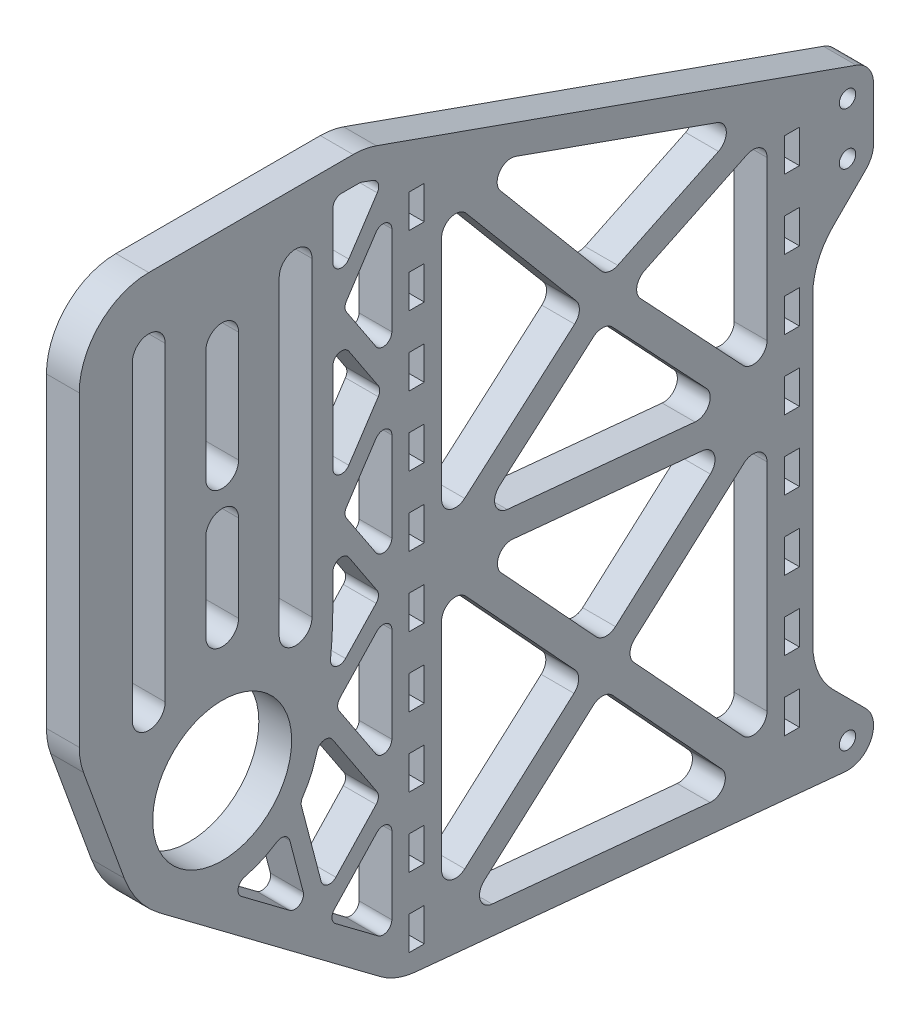
from build123d import *

# Parameters (mm, degrees)
SKETCH4_R               = 1.5
SKETCH4_R_2             = 19.05
SKETCH4_R_3             = 12.7
BOSS_EXTRUDE1_DEPTH     = 3
SKETCH5_W               = 2.75
SKETCH5_H               = 6.096
LOWERSLOT_DEPTH         = 120.792356667
SKETCH5_3_W             = 2.75
SKETCH5_3_H             = 6.096
UPPERSLOT_DEPTH         = 120.792356667
LOWERSLOTS_COUNT        = 8
LOWERSLOTS_PITCH        = 12.7
LPATTERN2_COUNT         = 10
LPATTERN2_PITCH         = 12.7
CUT_EXTRUDE1_DEPTH      = 120.792356667
CUT_EXTRUDE1_DEPTH_BACK = 120.792356667
CUT_EXTRUDE2_DEPTH      = 120.792356667
CUT_EXTRUDE2_DEPTH_BACK = 120.792356667
FILLET1_R               = 2.54
FILLET2_R               = 1.5875
FILLET3_R               = 12.7


with BuildPart() as part:
    # Sketch4 → Boss-Extrude1 (new, symmetric)
    # profile 1 of 3: a face of its own
    with BuildSketch(Plane(origin=(0, 0, 0), x_dir=(0, 0, -1), z_dir=(1, 0, 0))):
        with BuildLine():
            ThreePointArc((47.817596045, 22.032403955), (48.849976274, 23.577470153), (49.2125, 25.4))
            Line((49.2125, 25.4), (49.2125, 34.925))
            ThreePointArc((49.2125, 34.925), (48.339904561, 37.672735205), (46.041875851, 39.413578564))
            Line((46.041875851, 39.413578564), (-43.726606241, 71.25))
            Line((-43.726606241, 71.25), (-95.973393759, 71.25))
            Line((-95.973393759, 71.25), (-95.973393759, 0.199960648))
            Line((-95.973393759, 0.199960648), (-87.751144426, -22.39048373))
            ThreePointArc((-87.751144426, -22.39048373), (-73.157997785, 2.885587695), (-50.8, -15.875))
            ThreePointArc((-50.8, -15.875), (-61.330581006, -32.913837989), (-81.28, -31.115))
            Line((-81.28, -31.115), (-38.1, -63.5))
            Line((-38.1, -63.5), (43.992912904, -71.415514491))
            ThreePointArc((43.992912904, -71.415514491), (48.757334408, -68.706816071), (47.817596045, -63.307403955))
            Line((47.817596045, -63.307403955), (38.1, -53.589807909))
            Line((38.1, -53.589807909), (38.1, 12.314807909))
            Line((38.1, 12.314807909), (47.817596045, 22.032403955))
        make_face()
        with Locations((44.45, -66.675)):
            Circle(SKETCH4_R, mode=Mode.SUBTRACT)
        with BuildLine():
            ThreePointArc((-80.273393759, 1.775), (-83.273393759, -1.225), (-86.273393759, 1.775))
            Line((-86.273393759, 1.775), (-86.273393759, 58.55))
            ThreePointArc((-86.273393759, 58.55), (-83.273393759, 61.55), (-80.273393759, 58.55))
            Line((-80.273393759, 58.55), (-80.273393759, 1.775))
        make_face(mode=Mode.SUBTRACT)
        with BuildLine():
            ThreePointArc((-66.85, 8.3125), (-69.85, 5.3125), (-72.85, 8.3125))
            Line((-72.85, 8.3125), (-72.85, 24.1875))
            Line((-72.85, 24.1875), (-72.85, 33.3625))
            Line((-72.85, 33.3625), (-72.85, 53.6))
            ThreePointArc((-72.85, 53.6), (-69.85, 56.6), (-66.85, 53.6))
            Line((-66.85, 53.6), (-66.85, 33.3625))
            Line((-66.85, 33.3625), (-66.85, 24.1875))
            Line((-66.85, 24.1875), (-66.85, 8.3125))
        make_face(mode=Mode.SUBTRACT)
        with BuildLine():
            ThreePointArc((-53.426606241, 1.775), (-56.426606241, -1.225), (-59.426606241, 1.775))
            Line((-59.426606241, 1.775), (-59.426606241, 58.55))
            ThreePointArc((-59.426606241, 58.55), (-56.426606241, 61.55), (-53.426606241, 58.55))
            Line((-53.426606241, 58.55), (-53.426606241, 1.775))
        make_face(mode=Mode.SUBTRACT)
        with Locations((44.45, 25.4)):
            Circle(SKETCH4_R, mode=Mode.SUBTRACT)
        with Locations((44.45, 34.925)):
            Circle(SKETCH4_R, mode=Mode.SUBTRACT)
    # profile 2 of 3: a face of its own
    with BuildSketch(Plane(origin=(0, 0, 0), x_dir=(0, 0, -1), z_dir=(1, 0, 0))):
        with Locations((-69.85, -15.875)):
            Circle(SKETCH4_R_2)
        with Locations((-69.85, -15.875)):
            Circle(SKETCH4_R_3, mode=Mode.SUBTRACT)
    # profile 3 of 3: a face of its own
    with BuildSketch(Plane(origin=(0, 0, 0), x_dir=(0, 0, -1), z_dir=(1, 0, 0))):
        with BuildLine():
            Line((-72.85, 33.3625), (-72.85, 24.1875))
            ThreePointArc((-72.85, 24.1875), (-69.85, 27.1875), (-66.85, 24.1875))
            Line((-66.85, 24.1875), (-66.85, 33.3625))
            ThreePointArc((-66.85, 33.3625), (-69.85, 30.3625), (-72.85, 33.3625))
        make_face()
    extrude(amount=BOSS_EXTRUDE1_DEPTH, both=True)

    # Sketch5 → LowerSlot (cut, symmetric)
    with BuildSketch(Plane(origin=(3, 0, 0), x_dir=(0, 0, -1), z_dir=(1, 0, 0))):
        with Locations((34.29, -57.15)):
            Rectangle(SKETCH5_W, SKETCH5_H)
    lowerslot = extrude(amount=LOWERSLOT_DEPTH, both=True, mode=Mode.SUBTRACT)

    # Sketch5<3> → UpperSlot (cut, symmetric)
    with BuildSketch(Plane(origin=(3, 0, 0), x_dir=(0, 0, -1), z_dir=(1, 0, 0))):
        with Locations((-34.29, -57.15)):
            Rectangle(SKETCH5_3_W, SKETCH5_3_H)
    upperslot = extrude(amount=UPPERSLOT_DEPTH, both=True, mode=Mode.SUBTRACT)

    # LowerSlots: LowerSlot ×8
    with Locations(*[(0, i * LOWERSLOTS_PITCH, 0) for i in range(1, LOWERSLOTS_COUNT)]):
        add(lowerslot, mode=Mode.SUBTRACT)

    # LPattern2: UpperSlot ×10
    with Locations(*[(0, i * LPATTERN2_PITCH, 0) for i in range(1, LPATTERN2_COUNT)]):
        add(upperslot, mode=Mode.SUBTRACT)

    # Sketch6 → Cut-Extrude1 (cut, two sides: drawn at the far end of the back side and taken through both)
    with BuildSketch(Plane(origin=(3, 0, 0), x_dir=(0, 0, -1), z_dir=(1, 0, 0)).offset(-CUT_EXTRUDE1_DEPTH_BACK)):
        Polygon((-29.74, -4.159515549), (-29.74, -55.798883328), (-3.617530932, -32.497964764), align=None)
        Polygon((-0.173977051, -36.233636783), (-26.296446119, -59.534555348), (25.948492017, -64.572085997), align=None)
        Polygon((29.74, -9.550740101), (3.617530932, -32.851658666), (29.74, -61.190107881), align=None)
        Polygon((-23.36678753, -3.578249007), (0.173977051, -29.115986647), (23.714741632, -8.117916479), align=None)
        Polygon((-0.175685561, 22.007624532), (-23.626632395, 1.550365573), (23.275261273, -2.971981191), align=None)
        Polygon((4.225161053, 24.741958988), (29.74, -2.436074441), (29.74, 36.987638329), align=None)
        Polygon((26.36423534, 41.002246475), (-25.011163091, 59.222548276), (0.676536125, 28.673603984), align=None)
        Polygon((-29.74, 56.952974066), (-29.74, 2.958675399), (-3.549347816, 25.805895933), align=None)
    extrude(amount=CUT_EXTRUDE1_DEPTH + CUT_EXTRUDE1_DEPTH_BACK, mode=Mode.SUBTRACT)

    # Sketch6<3> → Cut-Extrude2 (cut, two sides: drawn at the far end of the back side and taken through both)
    with BuildSketch(Plane(origin=(3, 0, 0), x_dir=(0, 0, -1), z_dir=(1, 0, 0)).offset(-CUT_EXTRUDE2_DEPTH_BACK)):
        with BuildLine():
            Line((-69.433181898, -33.650113577), (-53.885950089, -45.310537433))
            Line((-53.885950089, -45.310537433), (-58.099239453, -29.218463815))
            ThreePointArc((-58.099239453, -29.218463815), (-63.375251167, -32.434167478), (-69.433181898, -33.650113577))
        make_face()
        Polygon((-50.566109593, -47.800417805), (-38.84, -56.595), (-38.84, -35.323421976), align=None)
        with BuildLine():
            ThreePointArc((-52.744055381, -20.724232793), (-53.887483076, -23.70612083), (-55.545901002, -26.435357563))
            Line((-55.545901002, -26.435357563), (-51.035185303, -43.663409762))
            Line((-51.035185303, -43.663409762), (-40.856390127, -32.832811265))
            Line((-40.856390127, -32.832811265), (-51.660229876, -16.473291387))
            ThreePointArc((-51.660229876, -16.473291387), (-52.173880395, -18.605967866), (-52.744055381, -20.724232793))
        make_face()
        Polygon((-49.180428609, -14.466821123), (-38.84, -30.124629024), (-38.84, -3.464238929), align=None)
        with BuildLine():
            ThreePointArc((-49.616606241, 1.775), (-49.882802907, -4.846843128), (-50.679674961, -11.425951122))
            Line((-50.679674961, -11.425951122), (-40.856390127, -0.973628217))
            Line((-40.856390127, -0.973628217), (-49.616606241, 12.291371355))
            Line((-49.616606241, 12.291371355), (-49.616606241, 1.775))
        make_face()
        Polygon((-47.71416834, 15.172103704), (-38.84, 1.734554024), (-38.84, 28.609653385), align=None)
        Polygon((-49.616606241, 44.927935415), (-49.616606241, 18.052836053), (-40.742437901, 31.490385734), align=None)
        Polygon((-47.71416834, 47.808667764), (-38.84, 34.371118083), (-38.84, 61.246217444), align=None)
        Polygon((-44.600745323, 66.17), (-49.616606241, 66.17), (-49.616606241, 58.55), (-49.616606241, 50.689400113), (-40.381419868, 64.673614852), align=None)
    extrude(amount=CUT_EXTRUDE2_DEPTH + CUT_EXTRUDE2_DEPTH_BACK, mode=Mode.SUBTRACT)

    # Fillet1
    fillet1_edges = [part.edges().sort_by_distance(p)[0] for p in [
        (0, -2.971981191, -23.275261273),
        (0, 1.550365573, 23.626632395),
        (0, 22.007624532, 0.175685561),
        (0, -3.578249007, 23.36678753),
        (0, -8.117916479, -23.714741632),
        (0, -29.115986647, -0.173977051),
        (0, -36.233636783, 0.173977051),
        (0, -64.572085997, -25.948492017),
        (0, -59.534555348, 26.296446119),
        (0, -32.851658666, -3.617530932),
        (0, -9.550740101, -29.74),
        (0, -61.190107881, -29.74),
        (0, 25.805895933, 3.549347816),
        (0, 2.958675399, 29.74),
        (0, 56.952974066, 29.74),
        (0, 24.741958988, -4.225161053),
        (0, 36.987638329, -29.74),
        (0, -2.436074441, -29.74),
        (0, 28.673603984, -0.676536125),
        (0, 59.222548276, 25.011163091),
        (0, 41.002246475, -26.36423534),
        (0, -4.159515549, 29.74),
        (0, -32.497964764, 3.617530932),
        (0, -55.798883328, 29.74),
    ]]
    fillet(fillet1_edges, radius=FILLET1_R)

    # Fillet2
    fillet2_edges = [part.edges().sort_by_distance(p)[0] for p in [
        (0, 64.673614852, 40.381419868),
        (0, 66.17, 44.600745323),
        (0, 66.17, 49.616606241),
        (0, 50.689400113, 49.616606241),
        (0, 47.808667764, 47.71416834),
        (0, 34.371118083, 38.84),
        (0, 61.246217444, 38.84),
        (0, 31.490385734, 40.742437901),
        (0, 44.927935415, 49.616606241),
        (0, 18.052836053, 49.616606241),
        (0, 15.172103704, 47.71416834),
        (0, 1.734554024, 38.84),
        (0, 28.609653385, 38.84),
        (0, -11.425951122, 50.679674961),
        (0, -0.973628217, 40.856390127),
        (0, 12.291371355, 49.616606241),
        (0, -30.124629024, 38.84),
        (0, -3.464238929, 38.84),
        (0, -26.435357563, 55.545901002),
        (0, -43.663409762, 51.035185303),
        (0, -32.832811265, 40.856390127),
        (0, -16.473291387, 51.660229876),
        (0, -35.323421976, 38.84),
        (0, -47.800417805, 50.566109593),
        (0, -56.595, 38.84),
        (0, -33.650113577, 69.433181898),
        (0, -45.310537433, 53.885950089),
        (0, -29.218463815, 58.099239453),
        (0, -14.466821123, 49.180428609),
    ]]
    fillet(fillet2_edges, radius=FILLET2_R)

    # Fillet3
    fillet3_edges = [part.edges().sort_by_distance(p)[0] for p in [
        (0, 12.314807909, -38.1),
        (0, -53.589807909, -38.1),
        (0, -63.5, 38.1),
        (0, 0.199960648, 95.973393759),
        (0, 71.25, 95.973393759),
        (0, 71.25, 43.726606241),
    ]]
    fillet(fillet3_edges, radius=FILLET3_R)


solid = part.part
